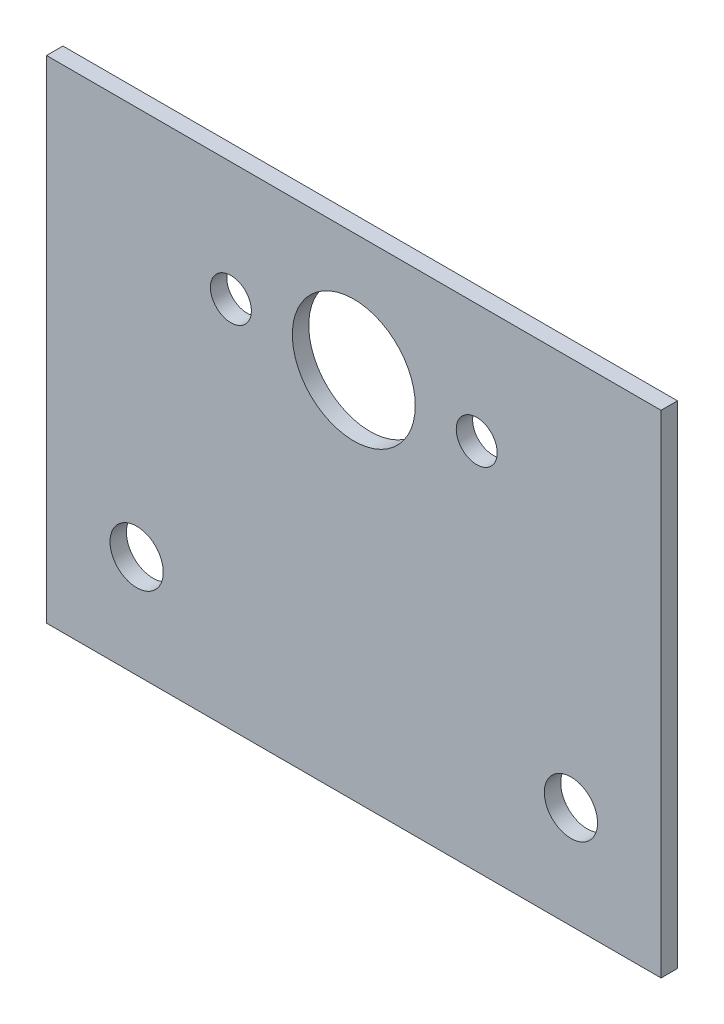
from build123d import *

# Parameters (mm, degrees)
SKETCH2_W           = 75
SKETCH2_H           = 60
SKETCH2_R           = 7.5
SKETCH2_R_2         = 3.25
SKETCH2_R_3         = 2.5
BOSS_EXTRUDE1_DEPTH = 2


with BuildPart() as part:
    # Sketch2 → Boss-Extrude1 (new body)
    with BuildSketch(Plane.XY):
        with Locations((37.5, 30)):
            Rectangle(SKETCH2_W, SKETCH2_H)
        with Locations((37.5, 45.5)):
            Circle(SKETCH2_R, mode=Mode.SUBTRACT)
        with Locations((64, 12.5)):
            Circle(SKETCH2_R_2, mode=Mode.SUBTRACT)
        with Locations(Location((11, 12.5, 0), (0, 0, 180))):
            Circle(SKETCH2_R_2, mode=Mode.SUBTRACT)
        with Locations((22.5, 45.5)):
            Circle(SKETCH2_R_3, mode=Mode.SUBTRACT)
        with Locations(Location((52.5, 45.5, 0), (0, 0, 180))):
            Circle(SKETCH2_R_3, mode=Mode.SUBTRACT)
    extrude(amount=BOSS_EXTRUDE1_DEPTH)


solid = part.part
